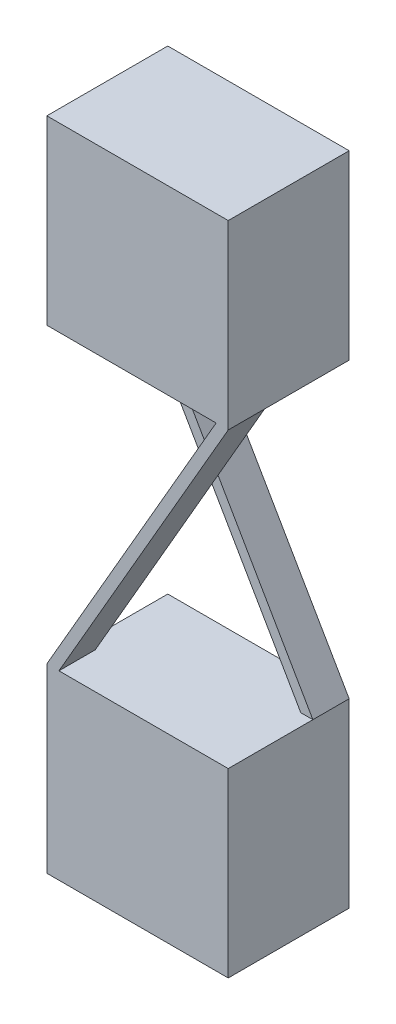
from build123d import *

# Parameters (mm, degrees)
SKETCH1_W             = 15
SKETCH1_H             = 15
BOSS_EXTRUDE1_DEPTH   = 5
BOSS_EXTRUDE1_2_DEPTH = 5
BOSS_EXTRUDE2_START   = 5
BOSS_EXTRUDE2_DEPTH   = 3
BOSS_EXTRUDE3_START   = -5
BOSS_EXTRUDE3_DEPTH   = 3


with BuildPart() as part:
    # Sketch1 → Boss-Extrude1 (new, symmetric)
    with BuildSketch(Plane.XY):
        with Locations((0, 19.624355653)):
            Rectangle(SKETCH1_W, SKETCH1_H)
    extrude(amount=BOSS_EXTRUDE1_DEPTH, both=True)



with BuildPart() as body_2:
    # Sketch1 → Boss-Extrude1 2 (new, symmetric)
    with BuildSketch(Plane.XY):
        with Locations((0, -19.624355653)):
            Rectangle(SKETCH1_W, SKETCH1_H)
    extrude(amount=BOSS_EXTRUDE1_2_DEPTH, both=True)


with BuildPart() as part_1:
    add(part.part)

    add(body_2.part)  # Boss-Extrude2 merges body 2
    # Sketch1<3> → Boss-Extrude2 (add)
    with BuildSketch(Plane.XY.offset(BOSS_EXTRUDE2_START)):
        Polygon((-6.5, -12.124355653), (0, -0.866025404), (-0.5, 0), (-7.5, -12.124355653), align=None)
        Polygon((0.5, 0), (7.5, 12.124355653), (6.5, 12.124355653), (0, 0.866025404), align=None)
        Polygon((0, -0.866025404), (0.5, 0), (0, 0.866025404), (-0.5, 0), align=None)
    extrude(amount=-BOSS_EXTRUDE2_DEPTH)

    # Sketch1<4> → Boss-Extrude3 (add)
    with BuildSketch(Plane.XY.offset(BOSS_EXTRUDE3_START)):
        Polygon((0, 0.866025404), (-6.5, 12.124355653), (-7.5, 12.124355653), (-0.5, 0), align=None)
        Polygon((7.5, -12.124355653), (0.5, 0), (0, -0.866025404), (6.5, -12.124355653), align=None)
        Polygon((0, -0.866025404), (0.5, 0), (0, 0.866025404), (-0.5, 0), align=None)
    extrude(amount=BOSS_EXTRUDE3_DEPTH)


solid = part_1.part
